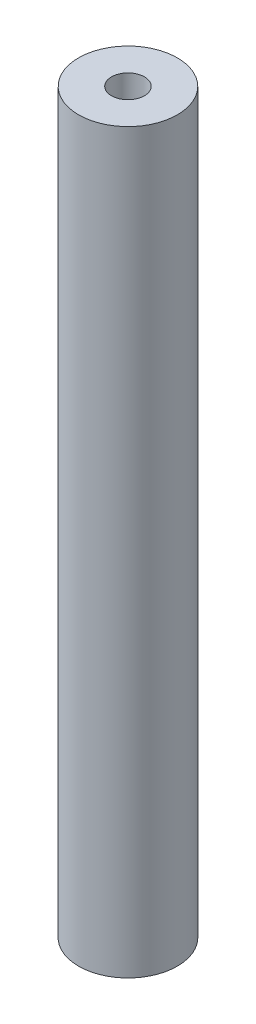
from build123d import *

# Parameters (mm, degrees)
SKETCH1_R           = 47.625
SKETCH1_R_2         = 15.875
BOSS_EXTRUDE1_DEPTH = 355.6


with BuildPart() as part:
    # Sketch1 → Boss-Extrude1 (new, symmetric)
    with BuildSketch(Plane(origin=(0, 0, 0), x_dir=(1, 0, 0), z_dir=(0, 1, 0))):
        with Locations(Location((0, 0, 0), (0, 0, 270))):
            Circle(SKETCH1_R)
        with Locations(Location((0, 0, 0), (0, 0, 270))):
            Circle(SKETCH1_R_2, mode=Mode.SUBTRACT)
    extrude(amount=BOSS_EXTRUDE1_DEPTH, both=True)


solid = part.part
